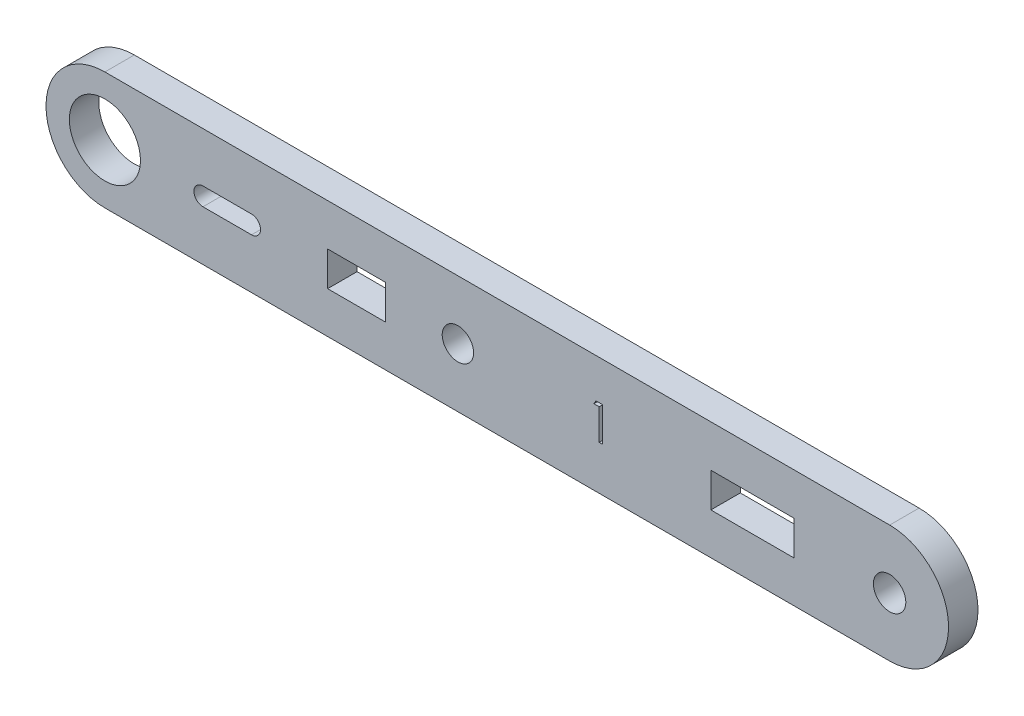
from build123d import *

# Parameters (mm, degrees)
SKETCH_1_R          = 1.65
SKETCH_1_R_2        = 3.62
SKETCH_1_W          = 5.910456895
SKETCH_1_H          = 3.506249455
SKETCH_1_W_2        = 8.468810135
EXTRUDE_1_DEPTH     = 3
SKETCH_2_R          = 1.6
CUT_EXTRUDE_1_DEPTH = 57.708942736
CUT_EXTRUDE_2_DEPTH = 1


with BuildPart() as part:
    # 草图1 → 凸台-拉伸1 (new body)
    with BuildSketch(Plane.XY.offset(3)):
        with BuildLine():
            Line((30.618171933, 12), (-49.343510787, 12))
            ThreePointArc((-49.343510787, 12), (-55.343510787, 6), (-49.343510787, 0))
            Line((-49.343510787, 0), (30.618171933, 0))
            ThreePointArc((30.618171933, 0), (36.618171933, 6), (30.618171933, 12))
        make_face()
        with Locations(Location((30.611606698, 6.0001, 0), (0, 0, 180))):
            Circle(SKETCH_1_R, mode=Mode.SUBTRACT)
        with Locations(Location((-49.343510787, 6, 0), (0, 0, 180))):
            Circle(SKETCH_1_R_2, mode=Mode.SUBTRACT)
        with Locations((-23.693418044, 5.97708776)):
            Rectangle(SKETCH_1_W, SKETCH_1_H, mode=Mode.SUBTRACT)
        with Locations((16.633615742, 5.97708776)):
            Rectangle(SKETCH_1_W_2, SKETCH_1_H, mode=Mode.SUBTRACT)
        with BuildLine():
            Line((-34.404739086, 5.1001), (-39.352347519, 5.1001))
            ThreePointArc((-39.352347519, 5.1001), (-40.269423986, 6.017176468), (-39.352347519, 6.934252935))
            Line((-39.352347519, 6.934252935), (-34.404739086, 6.934252935))
            ThreePointArc((-34.404739086, 6.934252935), (-33.487662618, 6.017176468), (-34.404739086, 5.1001))
        make_face(mode=Mode.SUBTRACT)
    extrude(amount=-EXTRUDE_1_DEPTH)

    # 草图2 → 切除-拉伸1 (cut, through all)
    with BuildSketch(Plane.XY.offset(3)):
        with Locations((-13.375343302, 6.0002)):
            Circle(SKETCH_2_R)
    extrude(amount=-CUT_EXTRUDE_1_DEPTH, mode=Mode.SUBTRACT)

    # 草图3 → 切除-拉伸2 (cut)
    with BuildSketch(Plane.XY.offset(3)):
        Polygon((0.687961553, 7.996886868), (1.335096969, 7.996886868), (1.335096969, 4.496886868), (1.020994405, 4.496886868), (1.020994405, 7.637912509), (0.482532867, 7.637912509), align=None)
    extrude(amount=-CUT_EXTRUDE_2_DEPTH, mode=Mode.SUBTRACT)


solid = part.part
